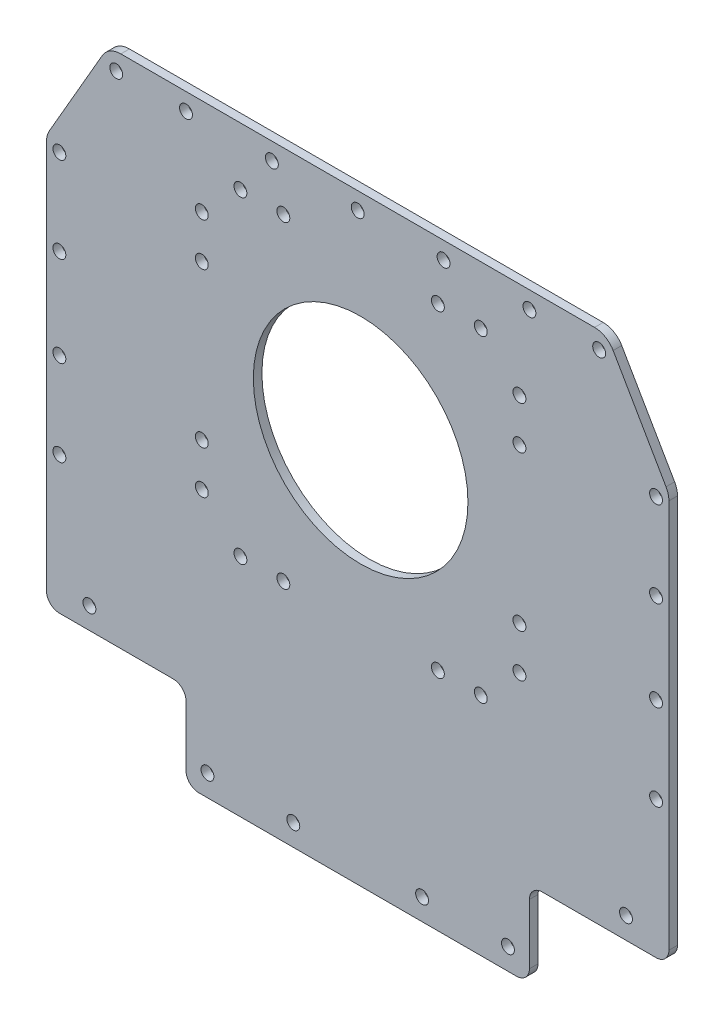
from build123d import *

# Parameters (mm, degrees)
SKETCH_1_R          = 1.5
EXTRUDE_1_DEPTH     = 2
SKETCH_2_R          = 25
CUT_EXTRUDE_1_DEPTH = 2


with BuildPart() as part:
    # 草图1 → 凸台-拉伸1 (new body)
    with BuildSketch(Plane.XY):
        with BuildLine():
            Line((-60.191772409, 67.5), (-72.512280484, 46.160254038))
            ThreePointArc((-72.512280484, 46.160254038), (-73.011782597, 44.954349263), (-73.182153465, 43.660254038))
            Line((-73.182153465, 43.660254038), (-73.182153465, -47))
            ThreePointArc((-73.182153465, -47), (-72.303473809, -49.121320344), (-70.182153465, -50))
            Line((-70.182153465, -50), (-43.682153465, -50))
            ThreePointArc((-43.682153465, -50), (-41.560833122, -50.878679656), (-40.682153465, -53))
            Line((-40.682153465, -53), (-40.682153465, -67))
            ThreePointArc((-40.682153465, -67), (-39.803473809, -69.121320344), (-37.682153465, -70))
            Line((-37.682153465, -70), (36.317846535, -70))
            ThreePointArc((36.317846535, -70), (38.439166878, -69.121320344), (39.317846535, -67))
            Line((39.317846535, -67), (39.317846535, -53))
            ThreePointArc((39.317846535, -53), (40.196526191, -50.878679656), (42.317846535, -50))
            Line((42.317846535, -50), (68.817846535, -50))
            ThreePointArc((68.817846535, -50), (70.939166878, -49.121320344), (71.817846535, -47))
            Line((71.817846535, -47), (71.817846535, 43.660254038))
            ThreePointArc((71.817846535, 43.660254038), (71.647475666, 44.954349263), (71.147973554, 46.160254038))
            Line((71.147973554, 46.160254038), (58.827465478, 67.5))
            ThreePointArc((58.827465478, 67.5), (56.997338459, 69.330127019), (54.497338459, 70))
            Line((54.497338459, 70), (-55.86164539, 70))
            ThreePointArc((-55.86164539, 70), (-58.36164539, 69.330127019), (-60.191772409, 67.5))
        make_face()
        with Locations((-0.682153465, 66)):
            Circle(SKETCH_1_R, mode=Mode.SUBTRACT)
        with Locations((-20.682153465, 66)):
            Circle(SKETCH_1_R, mode=Mode.SUBTRACT)
        with Locations((19.317846535, 66)):
            Circle(SKETCH_1_R, mode=Mode.SUBTRACT)
        with Locations((39.317846535, 66)):
            Circle(SKETCH_1_R, mode=Mode.SUBTRACT)
        with Locations((55.567846535, 66)):
            Circle(SKETCH_1_R, mode=Mode.SUBTRACT)
        with Locations((68.817846535, 43)):
            Circle(SKETCH_1_R, mode=Mode.SUBTRACT)
        with Locations((68.817846535, 23)):
            Circle(SKETCH_1_R, mode=Mode.SUBTRACT)
        with Locations((68.817846535, 2)):
            Circle(SKETCH_1_R, mode=Mode.SUBTRACT)
        with Locations((68.817846535, -18)):
            Circle(SKETCH_1_R, mode=Mode.SUBTRACT)
        with Locations((61.817846535, -45)):
            Circle(SKETCH_1_R, mode=Mode.SUBTRACT)
        with Locations((34.317846535, -65)):
            Circle(SKETCH_1_R, mode=Mode.SUBTRACT)
        with Locations((14.317846535, -65)):
            Circle(SKETCH_1_R, mode=Mode.SUBTRACT)
        with Locations((-15.682153465, -65)):
            Circle(SKETCH_1_R, mode=Mode.SUBTRACT)
        with Locations((-35.682153465, -65)):
            Circle(SKETCH_1_R, mode=Mode.SUBTRACT)
        with Locations((-63.182153465, -45)):
            Circle(SKETCH_1_R, mode=Mode.SUBTRACT)
        with Locations((-70.182153465, -18)):
            Circle(SKETCH_1_R, mode=Mode.SUBTRACT)
        with Locations((-70.182153465, 2)):
            Circle(SKETCH_1_R, mode=Mode.SUBTRACT)
        with Locations((-70.182153465, 23)):
            Circle(SKETCH_1_R, mode=Mode.SUBTRACT)
        with Locations((-70.182153465, 43)):
            Circle(SKETCH_1_R, mode=Mode.SUBTRACT)
        with Locations((-40.682153465, 66)):
            Circle(SKETCH_1_R, mode=Mode.SUBTRACT)
        with Locations((-56.932153465, 66)):
            Circle(SKETCH_1_R, mode=Mode.SUBTRACT)
        with Locations((-37.005212206, 37.538233198)):
            Circle(SKETCH_1_R, mode=Mode.SUBTRACT)
        with Locations((17.994787794, 56.538233198)):
            Circle(SKETCH_1_R, mode=Mode.SUBTRACT)
        with Locations((27.994787794, 56.538233198)):
            Circle(SKETCH_1_R, mode=Mode.SUBTRACT)
        with Locations((36.994787794, 47.538233198)):
            Circle(SKETCH_1_R, mode=Mode.SUBTRACT)
        with Locations((36.994787794, 37.538233198)):
            Circle(SKETCH_1_R, mode=Mode.SUBTRACT)
        with Locations((36.994787794, 1.538233198)):
            Circle(SKETCH_1_R, mode=Mode.SUBTRACT)
        with Locations((36.994787794, -8.461766802)):
            Circle(SKETCH_1_R, mode=Mode.SUBTRACT)
        with Locations((27.994787794, -17.461766802)):
            Circle(SKETCH_1_R, mode=Mode.SUBTRACT)
        with Locations((17.994787794, -17.461766802)):
            Circle(SKETCH_1_R, mode=Mode.SUBTRACT)
        with Locations((-18.005212206, -17.461766802)):
            Circle(SKETCH_1_R, mode=Mode.SUBTRACT)
        with Locations((-28.005212206, -17.461766802)):
            Circle(SKETCH_1_R, mode=Mode.SUBTRACT)
        with Locations((-37.005212206, -8.461766802)):
            Circle(SKETCH_1_R, mode=Mode.SUBTRACT)
        with Locations((-37.005212206, 1.538233198)):
            Circle(SKETCH_1_R, mode=Mode.SUBTRACT)
        with Locations((-18.005212206, 56.538233198)):
            Circle(SKETCH_1_R, mode=Mode.SUBTRACT)
        with Locations((-28.005212206, 56.538233198)):
            Circle(SKETCH_1_R, mode=Mode.SUBTRACT)
        with Locations((-37.005212206, 47.538233198)):
            Circle(SKETCH_1_R, mode=Mode.SUBTRACT)
    extrude(amount=EXTRUDE_1_DEPTH)

    # 草图2 → 切除-拉伸1 (cut)
    with BuildSketch(Plane.XY.offset(2)):
        with Locations((0, 20)):
            Circle(SKETCH_2_R)
    extrude(amount=-CUT_EXTRUDE_1_DEPTH, mode=Mode.SUBTRACT)


solid = part.part
